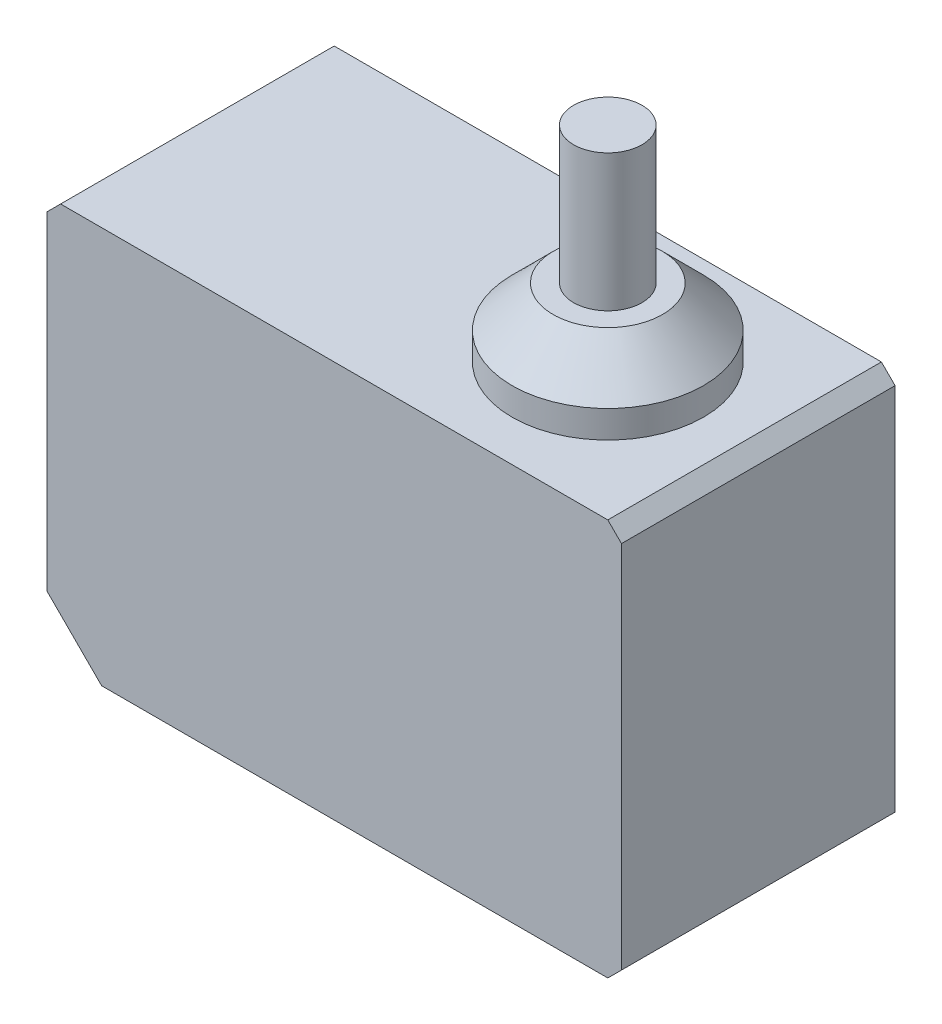
from build123d import *

# Parameters (mm, degrees)
SKETCH1_W           = 42
SKETCH1_H           = 29
BOSS_EXTRUDE1_DEPTH = 20
CHAMFER1_SIZE       = 4
CHAMFER2_SIZE       = 1
CHAMFER3_SIZE       = 1
SKETCH4_R           = 7
BOSS_EXTRUDE2_DEPTH = 5
CHAMFER4_SIZE       = 3
SKETCH5_R           = 2.5
BOSS_EXTRUDE3_DEPTH = 10


with BuildPart() as part:
    # Sketch1 → Boss-Extrude1 (new body)
    with BuildSketch(Plane.XY):
        with Locations((21, 14.5)):
            Rectangle(SKETCH1_W, SKETCH1_H)
    extrude(amount=BOSS_EXTRUDE1_DEPTH)

    # Chamfer1
    chamfer1_edges = [part.edges().sort_by_distance(p)[0] for p in [
        (0, 0, 10),
    ]]
    chamfer(chamfer1_edges, length=CHAMFER1_SIZE)

    # Chamfer2
    chamfer2_edges = [part.edges().sort_by_distance(p)[0] for p in [
        (0, 29, 10),
        (42, 29, 10),
    ]]
    chamfer(chamfer2_edges, length=CHAMFER2_SIZE)

    # Chamfer3
    chamfer3_edges = [part.edges().sort_by_distance(p)[0] for p in [
        (42, 0, 10),
    ]]
    chamfer(chamfer3_edges, length=CHAMFER3_SIZE)

    # Sketch4 → Boss-Extrude2 (add)
    with BuildSketch(Plane(origin=(0, 29, 0), x_dir=(1, 0, 0), z_dir=(0, 1, 0))):
        with Locations(Location((31, -10, 0), (0, 0, 90))):
            Circle(SKETCH4_R)
    extrude(amount=BOSS_EXTRUDE2_DEPTH)

    # Chamfer4
    chamfer4_edges = [part.edges().sort_by_distance(p)[0] for p in [
        (31, 34, 17),
    ]]
    chamfer(chamfer4_edges, length=CHAMFER4_SIZE)

    # Sketch5 → Boss-Extrude3 (add)
    with BuildSketch(Plane(origin=(0, 34, 0), x_dir=(1, 0, 0), z_dir=(0, 1, 0))):
        with Locations(Location((31, -10, 0), (0, 0, 270))):
            Circle(SKETCH5_R)
    extrude(amount=BOSS_EXTRUDE3_DEPTH)


solid = part.part
